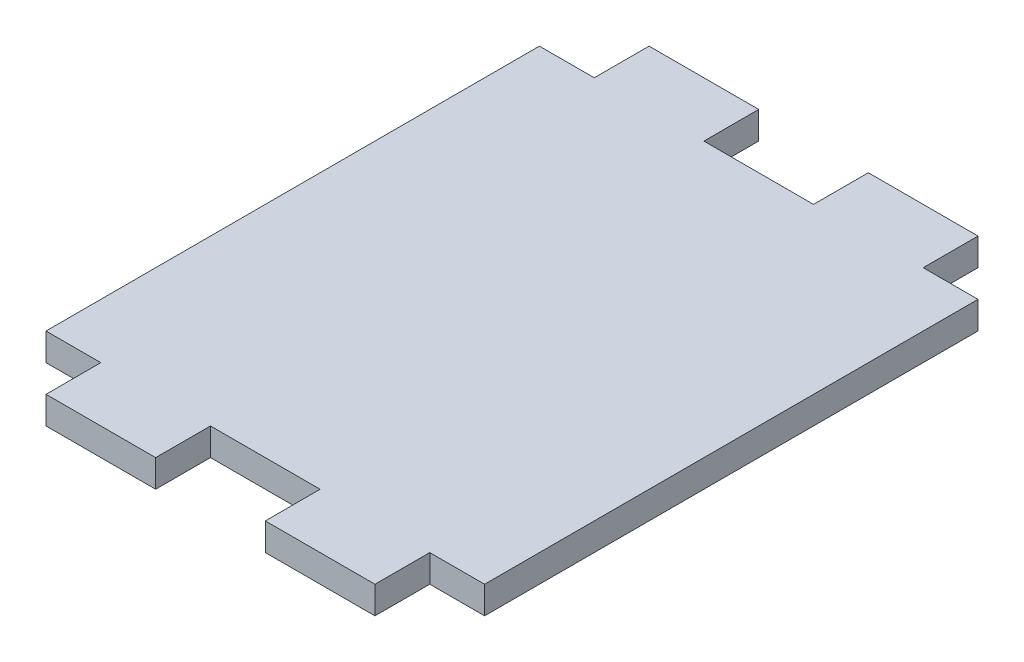
from build123d import *

# Parameters (mm, degrees)
SKETCH1_W           = 50.8
SKETCH1_H           = 3.175
BOSS_EXTRUDE1_DEPTH = 69.85
SKETCH2_W           = 6.35
SKETCH2_H           = 6.35
SKETCH2_W_2         = 12.7
CUT_EXTRUDE1_DEPTH  = 325.41579514


with BuildPart() as part:
    # Sketch1 → Boss-Extrude1 (new body)
    with BuildSketch(Plane.XY):
        with Locations((291.390948437, 357.142928402)):
            Rectangle(SKETCH1_W, SKETCH1_H)
    extrude(amount=-BOSS_EXTRUDE1_DEPTH)

    # Sketch2 → Cut-Extrude1 (cut, through all)
    with BuildSketch(Plane(origin=(0, 358.730428402, 0), x_dir=(1, 0, 0), z_dir=(0, 1, 0))):
        with Locations((269.165948437, 66.675)):
            Rectangle(SKETCH2_W, SKETCH2_H)
        with Locations((313.615948437, 66.675)):
            Rectangle(SKETCH2_W, SKETCH2_H)
        with Locations((291.390948437, 66.675)):
            Rectangle(SKETCH2_W_2, SKETCH2_H)
        with Locations((269.165948437, 3.175)):
            Rectangle(SKETCH2_W, SKETCH2_H)
        with Locations((291.390948437, 3.175)):
            Rectangle(SKETCH2_W_2, SKETCH2_H)
        with Locations((313.615948437, 3.175)):
            Rectangle(SKETCH2_W, SKETCH2_H)
    extrude(amount=-CUT_EXTRUDE1_DEPTH, mode=Mode.SUBTRACT)


solid = part.part
